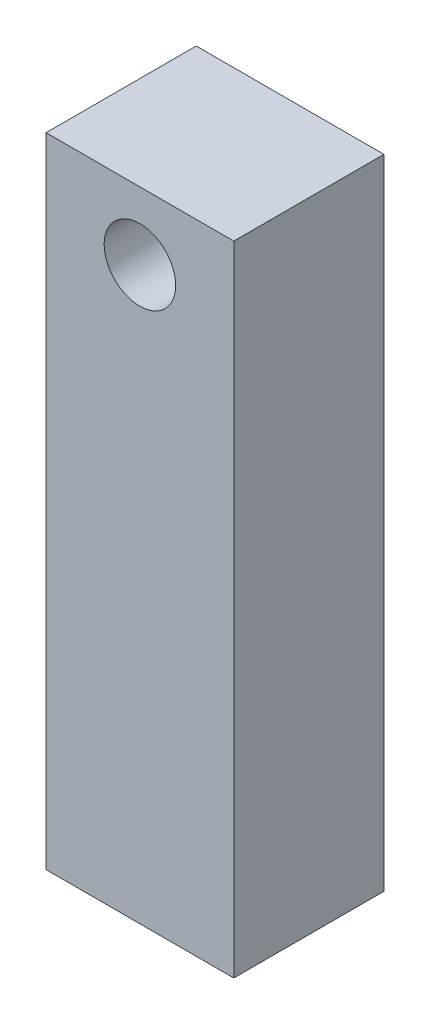
from build123d import *

# Parameters (mm, degrees)
SKETCH1_W           = 25
SKETCH1_H           = 20
BOSS_EXTRUDE1_DEPTH = 85
SKETCH2_R           = 4.7625
CUT_EXTRUDE1_DEPTH  = 12


with BuildPart() as part:
    # Sketch1 → Boss-Extrude1 (new body)
    with BuildSketch(Plane(origin=(0, 0, 0), x_dir=(1, 0, 0), z_dir=(0, 1, 0))):
        Rectangle(SKETCH1_W, SKETCH1_H)
    extrude(amount=BOSS_EXTRUDE1_DEPTH)

    # Sketch2 → Cut-Extrude1 (cut, symmetric)
    with BuildSketch(Plane.XY):
        with Locations((0, 76)):
            Circle(SKETCH2_R)
    extrude(amount=CUT_EXTRUDE1_DEPTH, both=True, mode=Mode.SUBTRACT)


solid = part.part
